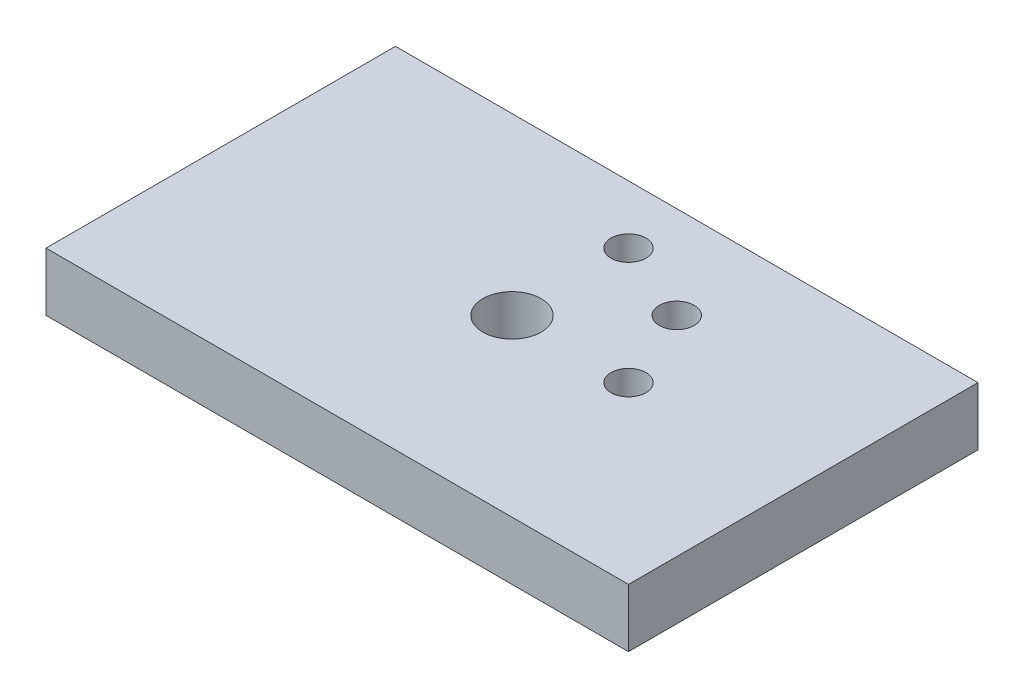
from build123d import *

# Parameters (mm, degrees)
SKETCH_1_W               = 100
SKETCH_1_H               = 60
EXTRUDE_1_DEPTH          = 10
SKETCH_2_R               = 5
CUT_EXTRUDE_1_DEPTH      = 20
SKETCH_3_R               = 3
CUT_EXTRUDE_2_DEPTH      = 20
PATTERN_CIRCULAR_1_COUNT = 3
PATTERN_CIRCULAR_1_ANGLE = 90


with BuildPart() as part:
    # 草图1 → 凸台-拉伸1 (new body)
    with BuildSketch(Plane(origin=(0, 0, 0), x_dir=(1, 0, 0), z_dir=(0, 1, 0))):
        Rectangle(SKETCH_1_W, SKETCH_1_H)
    extrude(amount=EXTRUDE_1_DEPTH)

    # 草图2 → 切除-拉伸1 (cut)
    with BuildSketch(Plane(origin=(0, 0, 0), x_dir=(1, 0, 0), z_dir=(0, 1, 0))):
        with Locations(Location((0, 0, 0), (0, 0, 90))):
            Circle(SKETCH_2_R)
    extrude(amount=CUT_EXTRUDE_1_DEPTH, mode=Mode.SUBTRACT)

    # 草图3 → 切除-拉伸2 (cut)
    with BuildSketch(Plane(origin=(0, 0, 0), x_dir=(1, 0, 0), z_dir=(0, 1, 0))):
        with Locations(Location((20, 0, 0), (0, 0, 90))):
            Circle(SKETCH_3_R)
    cut_extrude_2 = extrude(amount=CUT_EXTRUDE_2_DEPTH, mode=Mode.SUBTRACT)

    # 阵列(圆周)1: 切除-拉伸2 ×3 about axis
    pattern_circular_1_axis = Axis((0, 0, 0), (0, 1, 0))
    for i in range(1, PATTERN_CIRCULAR_1_COUNT):
        add(cut_extrude_2.rotate(pattern_circular_1_axis, i * PATTERN_CIRCULAR_1_ANGLE / (PATTERN_CIRCULAR_1_COUNT - 1)), mode=Mode.SUBTRACT)


solid = part.part
